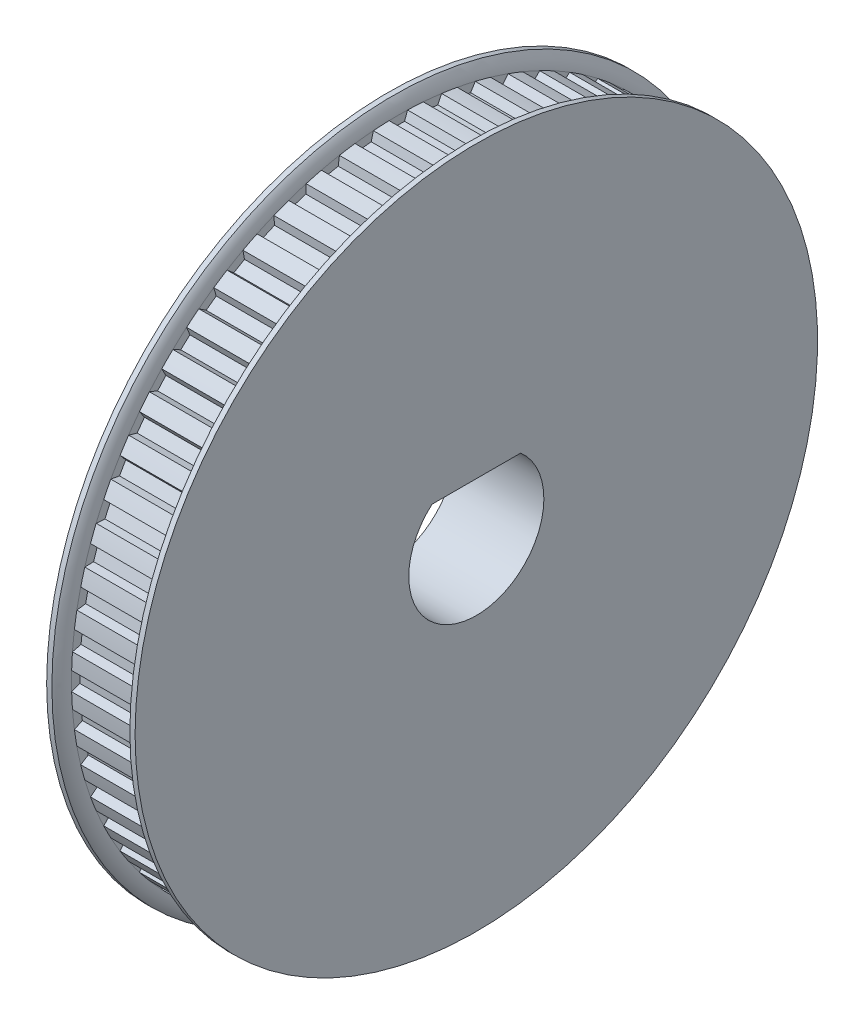
from build123d import *

# Parameters (mm, degrees)
CUT_EXTRUDE1_START = -0.7
CUT_EXTRUDE1_DEPTH = 9.7
CIRPATTERN1_COUNT  = 60
CUT_EXTRUDE2_DEPTH = 74.289085136


with BuildPart() as part:
    # Sketch6 → Revolve1 (revolve)
    with BuildSketch(Plane.XY, mode=Mode.PRIVATE) as revolve1_sk:
        with BuildLine():
            Line((10.5, 53), (9.75, 53))
            ThreePointArc((9.75, 53), (9.193253812, 52.028191393), (9, 50.925))
            Line((9, 50.925), (-0.7, 50.925))
            ThreePointArc((-0.7, 50.925), (-0.893253812, 52.028191393), (-1.45, 53))
            Line((-1.45, 53), (-2.2, 53))
            Line((-2.2, 53), (-2.2, 19))
            Line((-2.2, 19), (-2.2, 4))
            Line((-2.2, 4), (10.5, 4))
            Line((10.5, 4), (10.5, 53))
        make_face()
    revolve(revolve1_sk.sketch.rotate(Axis((-10.5, 4, 0), (1, 0, 0)), 90), axis=Axis((-10.5, 4, 0), (1, 0, 0)))

    # Sketch3 → Cut-Extrude1 (cut)
    with BuildSketch(Plane(origin=(0, 0, 0), x_dir=(0, 0, -1), z_dir=(1, 0, 0)).offset(CUT_EXTRUDE1_START)):
        with BuildLine():
            Line((-1.325, 50.907759723), (-0.891601041, 49.717005869))
            Line((-0.891601041, 49.717005869), (0.891601041, 49.717005869))
            Line((0.891601041, 49.717005869), (1.325, 50.907759723))
            ThreePointArc((1.325, 50.907759723), (0, 50.925), (-1.325, 50.907759723))
        make_face()
    cut_extrude1 = extrude(amount=CUT_EXTRUDE1_DEPTH, mode=Mode.SUBTRACT)

    # CirPattern1: Cut-Extrude1 ×60 about axis
    cirpattern1_axis = Axis((0, 4, 0), (1, 0, 0))
    for i in range(1, CIRPATTERN1_COUNT):
        add(cut_extrude1.rotate(cirpattern1_axis, i * 360 / CIRPATTERN1_COUNT), mode=Mode.SUBTRACT)

    # Sketch8 → Cut-Extrude2 (cut, through all)
    with BuildSketch(Plane.ZY.offset(2.2)):
        with BuildLine():
            Line((-6.361681676, 11.3225), (6.361681676, 11.3225))
            ThreePointArc((6.361681676, 11.3225), (0, -5.7), (-6.361681676, 11.3225))
        make_face()
    extrude(amount=-CUT_EXTRUDE2_DEPTH, mode=Mode.SUBTRACT)


solid = part.part
